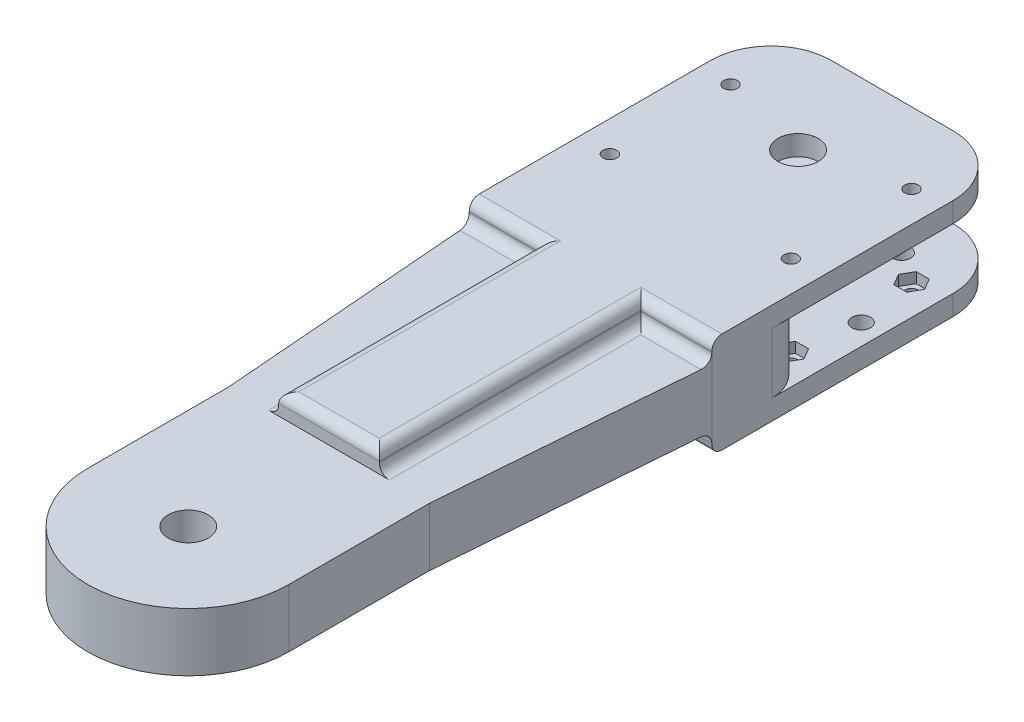
from build123d import *

# Parameters (mm, degrees)
SKETCH2_R               = 2.3
SKETCH2_R_2             = 1.7
BOSS_EXTRUDE1_DEPTH     = 5
BOSS_EXTRUDE2_DEPTH     = 5
SKETCH4_W               = 60.3
SKETCH4_H               = 15
BOSS_EXTRUDE3_DEPTH     = 15
SKETCH5_R               = 1.7
SKETCH5_R_2             = 5
BOSS_EXTRUDE4_DEPTH     = 5
SKETCH6_W               = 60.3
SKETCH6_H               = 15
BOSS_EXTRUDE5_DEPTH     = 10
FILLET1_R               = 10
CUT_EXTRUDE1_DEPTH      = 2.7
CUT_EXTRUDE1_DEPTH_BACK = 2.6
CUT_EXTRUDE2_DEPTH      = 2.7
CUT_EXTRUDE2_DEPTH_BACK = 2.6
SKETCH9_W               = 25
SKETCH9_H               = 25
BOSS_EXTRUDE6_DEPTH     = 65
BOSS_EXTRUDE7_DEPTH     = 7.25
SKETCH12_R              = 5
BOSS_EXTRUDE8_DEPTH     = 7.25
RIB1_REACH              = 172.454
SKETCH13_WALL_W         = 408.111678834
SKETCH13_WALL_H         = 14.5
RIB2_REACH              = 172.454
SKETCH14_WALL_W         = 408.111678834
SKETCH14_WALL_H         = 14.5
FILLET2_R               = 2.5
FILLET3_R               = 2.5


with BuildPart() as part:
    # Sketch2 → Boss-Extrude1 (new body)
    with BuildSketch(Plane(origin=(0, 0, 0), x_dir=(1, 0, 0), z_dir=(0, 1, 0))):
        with BuildLine():
            Line((15.15, -32.7), (-15.15, -32.7))
            ThreePointArc((-15.15, -32.7), (-25.756601718, -28.306601718), (-30.15, -17.7))
            Line((-30.15, -17.7), (-30.15, 17.7))
            ThreePointArc((-30.15, 17.7), (-25.756601718, 28.306601718), (-15.15, 32.7))
            Line((-15.15, 32.7), (15.15, 32.7))
            ThreePointArc((15.15, 32.7), (25.756601718, 28.306601718), (30.15, 17.7))
            Line((30.15, 17.7), (30.15, -17.7))
            ThreePointArc((30.15, -17.7), (25.756601718, -28.306601718), (15.15, -32.7))
        make_face()
        with Locations(Location((-15, 20, 0), (0, 0, 270))):
            Circle(SKETCH2_R, mode=Mode.SUBTRACT)
        with Locations(Location((-25, 0, 0), (0, 0, 270))):
            Circle(SKETCH2_R, mode=Mode.SUBTRACT)
        with Locations(Location((-15, -20, 0), (0, 0, 270))):
            Circle(SKETCH2_R, mode=Mode.SUBTRACT)
        with Locations(Location((-22.5, -15, 0), (0, 0, 270))):
            Circle(SKETCH2_R_2, mode=Mode.SUBTRACT)
        with Locations(Location((-22.5, 15, 0), (0, 0, 270))):
            Circle(SKETCH2_R_2, mode=Mode.SUBTRACT)
        with Locations(Location((15, 20, 0), (0, 0, 90))):
            Circle(SKETCH2_R, mode=Mode.SUBTRACT)
        with Locations(Location((22.5, 15, 0), (0, 0, 90))):
            Circle(SKETCH2_R_2, mode=Mode.SUBTRACT)
        with Locations(Location((25, 0, 0), (0, 0, 90))):
            Circle(SKETCH2_R, mode=Mode.SUBTRACT)
        with Locations(Location((22.5, -15, 0), (0, 0, 90))):
            Circle(SKETCH2_R_2, mode=Mode.SUBTRACT)
        with Locations(Location((15, -20, 0), (0, 0, 90))):
            Circle(SKETCH2_R, mode=Mode.SUBTRACT)
        with BuildLine():
            Line((-9, 4.716333345), (-9, -16.9))
            Line((-9, -16.9), (9, -16.9))
            Line((9, -16.9), (9, 4.716333345))
            ThreePointArc((9, 4.716333345), (0, 19.4), (-9, 4.716333345))
        make_face(mode=Mode.SUBTRACT)
    extrude(amount=BOSS_EXTRUDE1_DEPTH)

    # Sketch3 → Boss-Extrude2 (add)
    with BuildSketch(Plane.XZ):
        Polygon((-30.15, 17.7), (-30.15, 42.3), (30.15, 42.3), (30.15, 17.7), (15.15, 32.7), (-15.15, 32.7), align=None)
    extrude(amount=-BOSS_EXTRUDE2_DEPTH)

    # Sketch4 → Boss-Extrude3 (add)
    with BuildSketch(Plane(origin=(0, 5, 0), x_dir=(1, 0, 0), z_dir=(0, 1, 0))):
        with Locations((0, -34.8)):
            Rectangle(SKETCH4_W, SKETCH4_H)
    extrude(amount=BOSS_EXTRUDE3_DEPTH)

    # Sketch5 → Boss-Extrude4 (add)
    with BuildSketch(Plane(origin=(0, 20, 0), x_dir=(1, 0, 0), z_dir=(0, 1, 0))):
        with BuildLine():
            Line((-30.15, -42.3), (30.15, -42.3))
            Line((30.15, -42.3), (30.15, 17.7))
            ThreePointArc((30.15, 17.7), (25.756601718, 28.306601718), (15.15, 32.7))
            Line((15.15, 32.7), (-15.15, 32.7))
            ThreePointArc((-15.15, 32.7), (-25.756601718, 28.306601718), (-30.15, 17.7))
            Line((-30.15, 17.7), (-30.15, -42.3))
        make_face()
        with Locations(Location((-22.5, 15, 0), (0, 0, 270))):
            Circle(SKETCH5_R, mode=Mode.SUBTRACT)
        with Locations(Location((-22.5, -15, 0), (0, 0, 270))):
            Circle(SKETCH5_R, mode=Mode.SUBTRACT)
        with Locations(Location((22.5, 15, 0), (0, 0, 90))):
            Circle(SKETCH5_R, mode=Mode.SUBTRACT)
        with Locations(Location((22.5, -15, 0), (0, 0, 90))):
            Circle(SKETCH5_R, mode=Mode.SUBTRACT)
        with Locations(Location((0, 9.3, 0), (0, 0, 270))):
            Circle(SKETCH5_R_2, mode=Mode.SUBTRACT)
    extrude(amount=BOSS_EXTRUDE4_DEPTH)

    # Sketch6 → Boss-Extrude5 (add)
    with BuildSketch(Plane(origin=(0, 0, 27.3), x_dir=(-1, 0, 0), z_dir=(0, 0, -1))):
        with Locations((0, 12.5)):
            Rectangle(SKETCH6_W, SKETCH6_H)
    extrude(amount=BOSS_EXTRUDE5_DEPTH)

    # Fillet1
    fillet1_edges = [part.edges().sort_by_distance(p)[0] for p in [
        (30.15, 12.5, 17.3),
        (-30.15, 12.5, 17.3),
    ]]
    fillet(fillet1_edges, radius=FILLET1_R)

    # Sketch7 → Cut-Extrude1 (cut, two sides: drawn at the far end of the back side and taken through both)
    with BuildSketch(Plane(origin=(0, 5, 0), x_dir=(1, 0, 0), z_dir=(0, 1, 0)).offset(-CUT_EXTRUDE1_DEPTH_BACK)):
        Polygon((25.733161507, -15), (24.116580754, -12.2), (20.883419246, -12.2), (19.266838493, -15), (20.883419246, -17.8), (24.116580754, -17.8), align=None)
        Polygon((-24.116580754, -17.8), (-25.733161507, -15), (-24.116580754, -12.2), (-20.883419246, -12.2), (-19.266838493, -15), (-20.883419246, -17.8), align=None)
        Polygon((-19.266838493, 15), (-20.883419246, 17.8), (-24.116580754, 17.8), (-25.733161507, 15), (-24.116580754, 12.2), (-20.883419246, 12.2), align=None)
        Polygon((24.116580754, 17.8), (25.733161507, 15), (24.116580754, 12.2), (20.883419246, 12.2), (19.266838493, 15), (20.883419246, 17.8), align=None)
    extrude(amount=CUT_EXTRUDE1_DEPTH + CUT_EXTRUDE1_DEPTH_BACK, mode=Mode.SUBTRACT)

    # Sketch8 → Cut-Extrude2 (cut, two sides: drawn at the far end of the back side and taken through both)
    with BuildSketch(Plane.XZ.offset(-20).offset(-CUT_EXTRUDE2_DEPTH_BACK)):
        Polygon((25.733161507, 15), (24.116580754, 17.8), (20.883419246, 17.8), (19.266838493, 15), (20.883419246, 12.2), (24.116580754, 12.2), align=None)
        Polygon((-24.116580754, 12.2), (-25.733161507, 15), (-24.116580754, 17.8), (-20.883419246, 17.8), (-19.266838493, 15), (-20.883419246, 12.2), align=None)
        Polygon((-25.733161507, -15), (-24.116580754, -17.8), (-20.883419246, -17.8), (-19.266838493, -15), (-20.883419246, -12.2), (-24.116580754, -12.2), align=None)
        Polygon((24.116580754, -12.2), (25.733161507, -15), (24.116580754, -17.8), (20.883419246, -17.8), (19.266838493, -15), (20.883419246, -12.2), align=None)
    extrude(amount=CUT_EXTRUDE2_DEPTH + CUT_EXTRUDE2_DEPTH_BACK, mode=Mode.SUBTRACT)

    # Sketch9 → Boss-Extrude6 (add)
    with BuildSketch(Plane.XY.offset(42.3)):
        with Locations((0, 12.5)):
            Rectangle(SKETCH9_W, SKETCH9_H)
    extrude(amount=BOSS_EXTRUDE6_DEPTH)

    # Sketch11 → Boss-Extrude7 (add)
    with BuildSketch(Plane(origin=(0, 5.25, 0), x_dir=(1, 0, 0), z_dir=(0, 1, 0))):
        with BuildLine():
            Line((-25, -142.3), (-25, -107.3))
            Line((-25, -107.3), (25, -107.3))
            Line((25, -107.3), (25, -142.3))
            ThreePointArc((25, -142.3), (0, -167.3), (-25, -142.3))
        make_face()
        with BuildLine():
            Line((-3.75, -135.8), (-2.47446787, -126.943617116))
            ThreePointArc((-2.47446787, -126.943617116), (0, -124.8), (2.47446787, -126.943617116))
            Line((2.47446787, -126.943617116), (3.75, -135.8))
            Line((3.75, -135.8), (3.754165125, -135.802404736))
            Line((3.754165125, -135.802404736), (12.061783753, -132.478856522))
            ThreePointArc((12.061783753, -132.478856522), (15.155444566, -133.55), (14.536251623, -136.764760594))
            Line((14.536251623, -136.764760594), (7.504165125, -142.297595264))
            Line((7.504165125, -142.297595264), (7.504165125, -142.302404736))
            Line((7.504165125, -142.302404736), (14.536251623, -147.835239406))
            ThreePointArc((14.536251623, -147.835239406), (15.155444566, -151.05), (12.061783753, -152.121143478))
            Line((12.061783753, -152.121143478), (3.754165125, -148.797595264))
            Line((3.754165125, -148.797595264), (3.75, -148.8))
            Line((3.75, -148.8), (2.47446787, -157.656382884))
            ThreePointArc((2.47446787, -157.656382884), (0, -159.8), (-2.47446787, -157.656382884))
            Line((-2.47446787, -157.656382884), (-3.75, -148.8))
            Line((-3.75, -148.8), (-3.754165125, -148.797595264))
            Line((-3.754165125, -148.797595264), (-12.061783753, -152.121143478))
            ThreePointArc((-12.061783753, -152.121143478), (-15.155444566, -151.05), (-14.536251623, -147.835239406))
            Line((-14.536251623, -147.835239406), (-7.504165125, -142.302404736))
            Line((-7.504165125, -142.302404736), (-7.504165125, -142.297595264))
            Line((-7.504165125, -142.297595264), (-14.536251623, -136.764760594))
            ThreePointArc((-14.536251623, -136.764760594), (-15.155444566, -133.55), (-12.061783753, -132.478856522))
            Line((-12.061783753, -132.478856522), (-3.754165125, -135.802404736))
            Line((-3.754165125, -135.802404736), (-3.75, -135.8))
        make_face(mode=Mode.SUBTRACT)
    extrude(amount=BOSS_EXTRUDE7_DEPTH)

    # Sketch12 → Boss-Extrude8 (add)
    with BuildSketch(Plane(origin=(0, 12.5, 0), x_dir=(1, 0, 0), z_dir=(0, 1, 0))):
        with BuildLine():
            Line((-25, -142.3), (-25, -107.3))
            Line((-25, -107.3), (25, -107.3))
            Line((25, -107.3), (25, -142.3))
            ThreePointArc((25, -142.3), (0, -167.3), (-25, -142.3))
        make_face()
        with Locations(Location((0, -142.3, 0), (0, 0, 90))):
            Circle(SKETCH12_R, mode=Mode.SUBTRACT)
    extrude(amount=BOSS_EXTRUDE8_DEPTH)

    # Sketch13 wall → Rib1 (add, up to next)
    with BuildSketch(Plane(origin=(27.575, 12.5, 74.8), x_dir=(-0.078983247825, 0, 0.996875943417), z_dir=(0.996875943417, 0, 0.078983247825)), mode=Mode.PRIVATE) as rib1_sk1:
        Rectangle(SKETCH13_WALL_W, SKETCH13_WALL_H)
    rib1_tool1 = extrude(rib1_sk1.sketch, amount=-RIB1_REACH, mode=Mode.PRIVATE) - part.part
    add(rib1_tool1.solids().sort_by_distance((27.575, 12.5, 74.8))[0])

    # Sketch14 wall → Rib2 (add, up to next)
    with BuildSketch(Plane(origin=(-27.575, 12.5, 74.8), x_dir=(0.078983247825, 0, 0.996875943417), z_dir=(0.996875943417, 0, -0.078983247825)), mode=Mode.PRIVATE) as rib2_sk1:
        Rectangle(SKETCH14_WALL_W, SKETCH14_WALL_H)
    rib2_tool1 = extrude(rib2_sk1.sketch, amount=RIB2_REACH, mode=Mode.PRIVATE) - part.part
    add(rib2_tool1.solids().sort_by_distance((-27.575, 12.5, 74.8))[0])

    # Fillet2
    fillet2_edges = [part.edges().sort_by_distance(p)[0] for p in [
        (-21.325, 25, 42.3),
        (-21.325, 0, 42.3),
        (21.325, 25, 42.3),
        (-12.5, 25, 74.8),
        (-12.5, 0, 74.8),
        (12.5, 0, 74.8),
        (12.5, 25, 74.8),
        (0, 0, 107.3),
        (0, 25, 107.3),
        (21.325, 0, 42.3),
    ]]
    fillet(fillet2_edges, radius=FILLET2_R)

    # Fillet3
    fillet3_edges = [part.edges().sort_by_distance(p)[0] for p in [
        (21.325, 5.25, 42.3),
        (12.5, 5.25, 74.8),
        (12.5, 19.75, 74.8),
        (21.325, 19.75, 42.3),
        (-12.5, 19.75, 74.8),
        (-21.325, 5.25, 42.3),
        (-12.5, 5.25, 74.8),
        (-21.325, 19.75, 42.3),
    ]]
    fillet(fillet3_edges, radius=FILLET3_R)


solid = part.part
